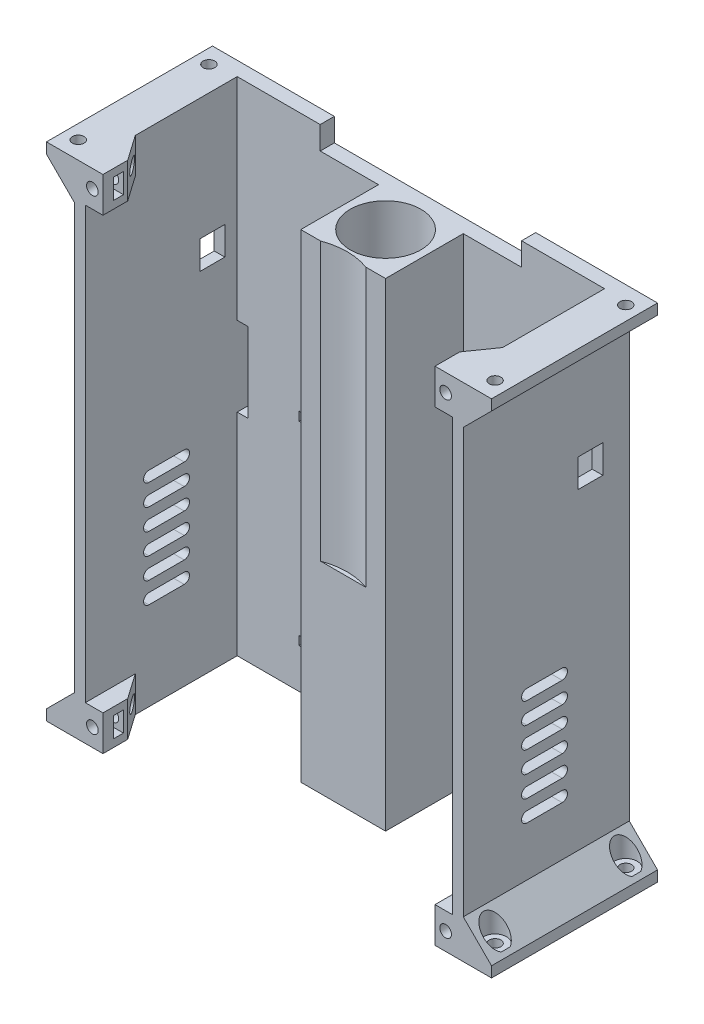
from build123d import *

# Parameters (mm, degrees)
SKETCH1_W                 = 110
SKETCH1_H                 = 142
BOSS_EXTRUDE1_DEPTH       = 4
SKETCH1_3_W               = 3
SKETCH1_3_H               = 142
BOSS_EXTRUDE2_DEPTH       = 43
BOSS_EXTRUDE10_DEPTH      = 47
SKETCH12_R                = 1.65
CUT_EXTRUDE3_DEPTH        = 14
CUT_EXTRUDE4_START        = -4
SKETCH12_3_R              = 3.25
SKETCH12_3_R_2            = 1.65
CUT_EXTRUDE4_DEPTH        = 14
BOSS_EXTRUDE11_DEPTH      = 10
SKETCH14_R                = 1.65
CUT_EXTRUDE5_DEPTH        = 18
CUT_EXTRUDE6_START        = -3
SKETCH14_3_W              = 6.5
SKETCH14_3_H              = 5.7
SKETCH14_3_R              = 1.65
CUT_EXTRUDE6_DEPTH        = 2.8
MIRROR2_COPY_1_DEPTH      = 47
MIRROR2_COPY_2_SKETCH_R   = 1.65
MIRROR2_COPY_2_DEPTH      = 14
MIRROR2_START             = -4
MIRROR2_COPY_3_SKETCH_R   = 3.25
MIRROR2_COPY_3_SKETCH_R_2 = 1.65
MIRROR2_COPY_3_DEPTH      = 14
MIRROR2_COPY_4_DEPTH      = 10
MIRROR2_COPY_5_SKETCH_R   = 1.65
MIRROR2_COPY_5_DEPTH      = 18
MIRROR2_START_2           = -3
MIRROR2_COPY_6_SKETCH_W   = 6.5
MIRROR2_COPY_6_SKETCH_H   = 5.7
MIRROR2_COPY_6_SKETCH_R   = 1.65
MIRROR2_COPY_6_DEPTH      = 2.8
SKETCH17_W                = 24
SKETCH17_H                = 22
SKETCH17_R                = 9.99
BOSS_EXTRUDE12_DEPTH      = 142
SKETCH18_W                = 5
SKETCH18_H                = 2.5
SKETCH18_W_2              = 3
SKETCH18_H_2              = 22.5
CUT_EXTRUDE7_DEPTH        = 15.1
SKETCH19_R                = 18.5
CUT_EXTRUDE8_DEPTH        = 85
SKETCH20_W                = 57
SKETCH20_H                = 6.5
CUT_EXTRUDE9_DEPTH        = 47
CUT_EXTRUDE10_DEPTH       = 10
SKETCH24_W                = 7
SKETCH24_H                = 8
CUT_EXTRUDE12_DEPTH       = 15


with BuildPart() as part:
    # Sketch1 → Boss-Extrude1 (new body)
    with BuildSketch(Plane.XY):
        Rectangle(SKETCH1_W, SKETCH1_H)
    extrude(amount=-BOSS_EXTRUDE1_DEPTH)

    # Sketch1<3> → Boss-Extrude2 (add)
    with BuildSketch(Plane.XY):
        with Locations((-53.5, 0)):
            Rectangle(SKETCH1_3_W, SKETCH1_3_H)
        with Locations((53.5, 0)):
            Rectangle(SKETCH1_3_W, SKETCH1_3_H)
    extrude(amount=BOSS_EXTRUDE2_DEPTH)

    # Sketch11 → Boss-Extrude10 (add)
    with BuildSketch(Plane.XY.offset(43)):
        Polygon((55, 71), (63, 71), (63, 68), (55, 60), align=None)
    boss_extrude10 = extrude(amount=-BOSS_EXTRUDE10_DEPTH)

    # Sketch12 → Cut-Extrude3 (cut)
    with BuildSketch(Plane(origin=(0, 71, 0), x_dir=(1, 0, 0), z_dir=(0, 1, 0))):
        with Locations(Location((59, -38, 0), (0, 0, 270))):
            Circle(SKETCH12_R)
        with Locations(Location((59, -1, 0), (0, 0, 270))):
            Circle(SKETCH12_R)
    cut_extrude3 = extrude(amount=-CUT_EXTRUDE3_DEPTH, mode=Mode.SUBTRACT)

    # Sketch12<3> → Cut-Extrude4 (cut)
    # profile 1 of 2: a face of its own
    with BuildSketch(Plane(origin=(0, 71, 0), x_dir=(1, 0, 0), z_dir=(0, 1, 0)).offset(CUT_EXTRUDE4_START)):
        with Locations((59, -38)):
            Circle(SKETCH12_3_R)
        with Locations(Location((59, -38, 0), (0, 0, 270))):
            Circle(SKETCH12_3_R_2, mode=Mode.SUBTRACT)
    # profile 2 of 2: a face of its own
    with BuildSketch(Plane(origin=(0, 71, 0), x_dir=(1, 0, 0), z_dir=(0, 1, 0)).offset(CUT_EXTRUDE4_START)):
        with Locations((59, -1)):
            Circle(SKETCH12_3_R)
        with Locations(Location((59, -1, 0), (0, 0, 270))):
            Circle(SKETCH12_3_R_2, mode=Mode.SUBTRACT)
    cut_extrude4 = extrude(amount=-CUT_EXTRUDE4_DEPTH, mode=Mode.SUBTRACT)

    # Sketch13 → Boss-Extrude11 (add)
    with BuildSketch(Plane(origin=(0, 71, 0), x_dir=(1, 0, 0), z_dir=(0, 1, 0))):
        Polygon((52, -43), (47, -43), (47, -36), (52, -28.859259966), align=None)
    boss_extrude11 = extrude(amount=-BOSS_EXTRUDE11_DEPTH)

    # Sketch14 → Cut-Extrude5 (cut)
    with BuildSketch(Plane.XY.offset(43)):
        with Locations((50, 66)):
            Circle(SKETCH14_R)
    cut_extrude5 = extrude(amount=-CUT_EXTRUDE5_DEPTH, mode=Mode.SUBTRACT)

    # Sketch14<3> → Cut-Extrude6 (cut)
    with BuildSketch(Plane.XY.offset(43).offset(CUT_EXTRUDE6_START)):
        with Locations((50.25, 66)):
            Rectangle(SKETCH14_3_W, SKETCH14_3_H)
        with Locations((50, 66)):
            Circle(SKETCH14_3_R, mode=Mode.SUBTRACT)
    cut_extrude6 = extrude(amount=-CUT_EXTRUDE6_DEPTH, mode=Mode.SUBTRACT)

    # Mirror1: Boss-Extrude10, Cut-Extrude3, Cut-Extrude4, Boss-Extrude11, Cut-Extrude5, Cut-Extrude6 across plane
    add(boss_extrude10.mirror(Plane.ZX))
    add(cut_extrude3.mirror(Plane.ZX), mode=Mode.SUBTRACT)
    add(cut_extrude4.mirror(Plane.ZX), mode=Mode.SUBTRACT)
    add(boss_extrude11.mirror(Plane.ZX))
    add(cut_extrude5.mirror(Plane.ZX), mode=Mode.SUBTRACT)
    add(cut_extrude6.mirror(Plane.ZX), mode=Mode.SUBTRACT)

    # Mirror2: Boss-Extrude10, Cut-Extrude3, Cut-Extrude4, Boss-Extrude11, Cut-Extrude5, Cut-Extrude6 across plane
    add(boss_extrude10.mirror(Plane(origin=(0, 0, 0), x_dir=(0, 0, 1), z_dir=(1, 0, 0))))
    add(cut_extrude3.mirror(Plane(origin=(0, 0, 0), x_dir=(0, 0, 1), z_dir=(1, 0, 0))), mode=Mode.SUBTRACT)
    add(cut_extrude4.mirror(Plane(origin=(0, 0, 0), x_dir=(0, 0, 1), z_dir=(1, 0, 0))), mode=Mode.SUBTRACT)
    add(boss_extrude11.mirror(Plane(origin=(0, 0, 0), x_dir=(0, 0, 1), z_dir=(1, 0, 0))))
    add(cut_extrude5.mirror(Plane(origin=(0, 0, 0), x_dir=(0, 0, 1), z_dir=(1, 0, 0))), mode=Mode.SUBTRACT)
    add(cut_extrude6.mirror(Plane(origin=(0, 0, 0), x_dir=(0, 0, 1), z_dir=(1, 0, 0))), mode=Mode.SUBTRACT)

    # Mirror2 copy 1 sketch → Mirror2 copy 1 (add)
    with BuildSketch(Plane(origin=(0, 0, 43), x_dir=(-1, 0, 0), z_dir=(0, 0, 1))):
        Polygon((55, 71), (63, 71), (63, 68), (55, 60), align=None)
    extrude(amount=-MIRROR2_COPY_1_DEPTH)

    # Mirror2 copy 2 sketch → Mirror2 copy 2 (cut)
    with BuildSketch(Plane(origin=(0, -71, 0), x_dir=(-1, 0, 0), z_dir=(0, -1, 0))):
        with Locations(Location((59, -38, 0), (0, 0, 270))):
            Circle(MIRROR2_COPY_2_SKETCH_R)
        with Locations(Location((59, -1, 0), (0, 0, 270))):
            Circle(MIRROR2_COPY_2_SKETCH_R)
    extrude(amount=-MIRROR2_COPY_2_DEPTH, mode=Mode.SUBTRACT)

    # Mirror2 copy 3 sketch → Mirror2 copy 3 (cut)
    # profile 1 of 2: a face of its own
    with BuildSketch(Plane(origin=(0, -71, 0), x_dir=(-1, 0, 0), z_dir=(0, -1, 0)).offset(MIRROR2_START)):
        with Locations((59, -38)):
            Circle(MIRROR2_COPY_3_SKETCH_R)
        with Locations(Location((59, -38, 0), (0, 0, 270))):
            Circle(MIRROR2_COPY_3_SKETCH_R_2, mode=Mode.SUBTRACT)
    # profile 2 of 2: a face of its own
    with BuildSketch(Plane(origin=(0, -71, 0), x_dir=(-1, 0, 0), z_dir=(0, -1, 0)).offset(MIRROR2_START)):
        with Locations((59, -1)):
            Circle(MIRROR2_COPY_3_SKETCH_R)
        with Locations(Location((59, -1, 0), (0, 0, 270))):
            Circle(MIRROR2_COPY_3_SKETCH_R_2, mode=Mode.SUBTRACT)
    extrude(amount=-MIRROR2_COPY_3_DEPTH, mode=Mode.SUBTRACT)

    # Mirror2 copy 4 sketch → Mirror2 copy 4 (add)
    with BuildSketch(Plane(origin=(0, -71, 0), x_dir=(-1, 0, 0), z_dir=(0, -1, 0))):
        Polygon((52, -43), (47, -43), (47, -36), (52, -28.859259966), align=None)
    extrude(amount=-MIRROR2_COPY_4_DEPTH)

    # Mirror2 copy 5 sketch → Mirror2 copy 5 (cut)
    with BuildSketch(Plane(origin=(0, 0, 43), x_dir=(-1, 0, 0), z_dir=(0, 0, 1))):
        with Locations((50, 66)):
            Circle(MIRROR2_COPY_5_SKETCH_R)
    extrude(amount=-MIRROR2_COPY_5_DEPTH, mode=Mode.SUBTRACT)

    # Mirror2 copy 6 sketch → Mirror2 copy 6 (cut)
    with BuildSketch(Plane(origin=(0, 0, 43), x_dir=(-1, 0, 0), z_dir=(0, 0, 1)).offset(MIRROR2_START_2)):
        with Locations((50.25, 66)):
            Rectangle(MIRROR2_COPY_6_SKETCH_W, MIRROR2_COPY_6_SKETCH_H)
        with Locations((50, 66)):
            Circle(MIRROR2_COPY_6_SKETCH_R, mode=Mode.SUBTRACT)
    extrude(amount=-MIRROR2_COPY_6_DEPTH, mode=Mode.SUBTRACT)

    # Sketch17 → Boss-Extrude12 (add)
    with BuildSketch(Plane.XZ.offset(71)):
        with Locations((0, 11)):
            Rectangle(SKETCH17_W, SKETCH17_H)
        with Locations(Location((0, 10, 0), (0, 0, 270))):
            Circle(SKETCH17_R, mode=Mode.SUBTRACT)
    extrude(amount=-BOSS_EXTRUDE12_DEPTH)

    # Sketch18 → Cut-Extrude7 (cut)
    with BuildSketch(Plane.XY):
        with Locations((-32, -58.5)):
            Rectangle(SKETCH18_W, SKETCH18_H)
        with Locations((-32, -3.5)):
            Rectangle(SKETCH18_W, SKETCH18_H)
        with Locations((13.5, 0)):
            Rectangle(SKETCH18_W_2, SKETCH18_H_2)
        with Locations((50.5, 0)):
            Rectangle(SKETCH18_W_2, SKETCH18_H_2)
    cut_extrude7 = extrude(amount=-CUT_EXTRUDE7_DEPTH, mode=Mode.SUBTRACT)

    # Sketch19 → Cut-Extrude8 (cut)
    with BuildSketch(Plane(origin=(0, 71, 0), x_dir=(1, 0, 0), z_dir=(0, 1, 0))):
        with Locations((0, -39.35)):
            Circle(SKETCH19_R)
    extrude(amount=-CUT_EXTRUDE8_DEPTH, mode=Mode.SUBTRACT)

    # Sketch20 → Cut-Extrude9 (cut)
    with BuildSketch(Plane(origin=(0, 0, -4), x_dir=(-1, 0, 0), z_dir=(0, 0, -1))):
        with Locations((0, 67.75)):
            Rectangle(SKETCH20_W, SKETCH20_H)
    extrude(amount=-CUT_EXTRUDE9_DEPTH, mode=Mode.SUBTRACT)

    # Mirror3: Cut-Extrude7 across plane
    add(cut_extrude7.mirror(Plane(origin=(0, 0, 0), x_dir=(0, 0, 1), z_dir=(1, 0, 0))), mode=Mode.SUBTRACT)

    # Sketch21 → Cut-Extrude10 (cut)
    with BuildSketch(Plane.ZY.offset(55)):
        with BuildLine():
            Line((25, -46), (15, -46))
            ThreePointArc((15, -46), (13.5, -44.5), (15, -43))
            Line((15, -43), (25, -43))
            ThreePointArc((25, -43), (26.5, -44.5), (25, -46))
        make_face()
        with BuildLine():
            Line((25, -40), (15, -40))
            ThreePointArc((15, -40), (13.5, -38.5), (15, -37))
            Line((15, -37), (25, -37))
            ThreePointArc((25, -37), (26.5, -38.5), (25, -40))
        make_face()
        with BuildLine():
            Line((25, -34), (15, -34))
            ThreePointArc((15, -34), (13.5, -32.5), (15, -31))
            Line((15, -31), (25, -31))
            ThreePointArc((25, -31), (26.5, -32.5), (25, -34))
        make_face()
        with BuildLine():
            Line((25, -28), (15, -28))
            ThreePointArc((15, -28), (13.5, -26.5), (15, -25))
            Line((15, -25), (25, -25))
            ThreePointArc((25, -25), (26.5, -26.5), (25, -28))
        make_face()
        with BuildLine():
            Line((25, -22), (15, -22))
            ThreePointArc((15, -22), (13.5, -20.5), (15, -19))
            Line((15, -19), (25, -19))
            ThreePointArc((25, -19), (26.5, -20.5), (25, -22))
        make_face()
        with BuildLine():
            Line((25, -16), (15, -16))
            ThreePointArc((15, -16), (13.5, -14.5), (15, -13))
            Line((15, -13), (25, -13))
            ThreePointArc((25, -13), (26.5, -14.5), (25, -16))
        make_face()
    cut_extrude10 = extrude(amount=-CUT_EXTRUDE10_DEPTH, mode=Mode.SUBTRACT)

    # Mirror4: Cut-Extrude10 across plane
    add(cut_extrude10.mirror(Plane(origin=(0, 0, 0), x_dir=(0, 0, 1), z_dir=(1, 0, 0))), mode=Mode.SUBTRACT)

    # Sketch24 → Cut-Extrude12 (cut)
    with BuildSketch(Plane(origin=(-52, 0, 0), x_dir=(0, 0, -1), z_dir=(1, 0, 0))):
        with Locations((-7, 32.5)):
            Rectangle(SKETCH24_W, SKETCH24_H)
    cut_extrude12 = extrude(amount=-CUT_EXTRUDE12_DEPTH, mode=Mode.SUBTRACT)

    # Mirror5: Cut-Extrude12 across plane
    add(cut_extrude12.mirror(Plane(origin=(0, 0, 0), x_dir=(0, 0, 1), z_dir=(1, 0, 0))), mode=Mode.SUBTRACT)


solid = part.part
